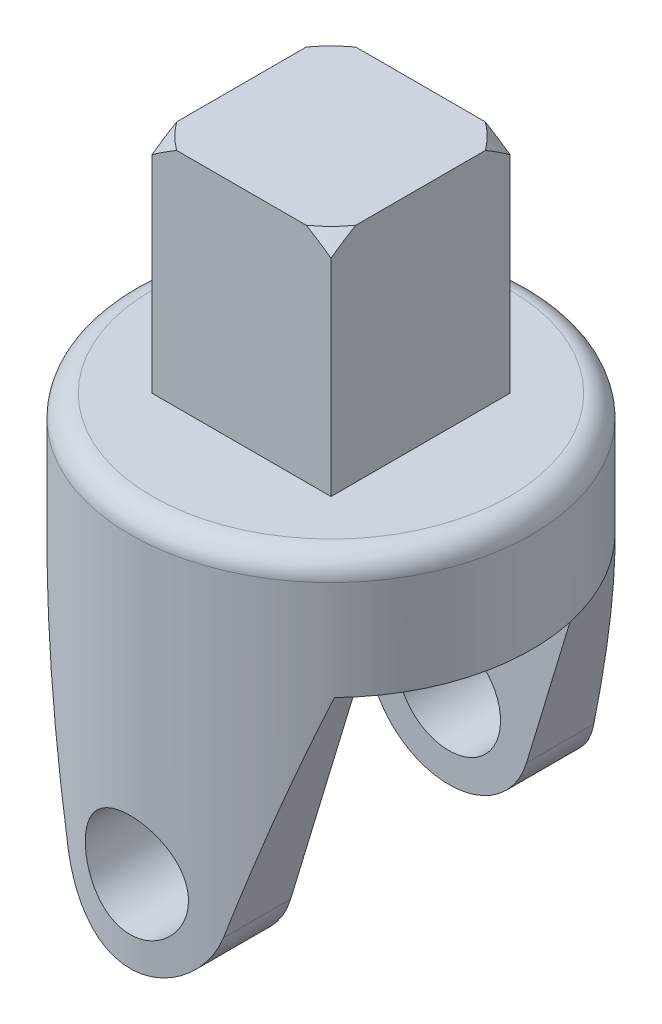
from build123d import *

# Parameters (mm, degrees)
BASE_R                  = 6.9215
BASE_EXTRUDE_DEPTH      = 13.716
MALEDRIVE_R             = 6.0579
DRIVE_EXTRUDE_DEPTH     = 7.6708
SQDRIVE_SK_OUTSIDE_W    = 21.642
SQDRIVE_SK_OUTSIDE_H    = 21.642
SQDRIVE_SK_OUTSIDE_W_2  = 6.1722
SQDRIVE_SK_OUTSIDE_H_2  = 6.1722
DRIVE_SQCUT_DEPTH       = 7.6708
BASE_FILLET_TOP_R       = 0.762
PROFILE1_CUT_DEPTH      = 24.520406857
PROFILE1_CUT_DEPTH_BACK = 24.520406857
PROFILE1_CUTSK_W        = 8.128
PROFILE1_CUTSK_H        = 9.525
PROFILE2_CUT_DEPTH      = 24.520406857
PROFILE2_CUT_DEPTH_BACK = 24.520406857
PIN_CUT_DEPTH           = 24.520406916
PIN_CUT_DEPTH_BACK      = 24.520406916
PIN_CUTSK_R             = 1.778


with BuildPart() as part:
    # Base → Base-Extrude (new body)
    with BuildSketch(Plane(origin=(0, 0, 0), x_dir=(1, 0, 0), z_dir=(0, 1, 0))):
        with Locations(Location((0, 0, 0), (0, 0, 270))):
            Circle(BASE_R)
    extrude(amount=BASE_EXTRUDE_DEPTH)

    # MaleDrive → Drive-Extrude (add)
    with BuildSketch(Plane(origin=(0, 13.716, 0), x_dir=(1, 0, 0), z_dir=(0, 1, 0))):
        with Locations(Location((0, 0, 0), (0, 0, 270))):
            Circle(MALEDRIVE_R)
    extrude(amount=DRIVE_EXTRUDE_DEPTH)

    # Drive-ChamCut → DriveEnd-Chamfer (revolve, cut)
    with BuildSketch(Plane.XY, mode=Mode.PRIVATE) as driveend_chamfer_sk:
        Polygon((-3.81, 21.3868), (-5.4229, 19.7739), (-5.4229, 21.3868), align=None)
    revolve(driveend_chamfer_sk.sketch.rotate(Axis((0, 0, 0), (0, 1, 0)), 270), axis=Axis((0, 0, 0), (0, 1, 0)), mode=Mode.SUBTRACT)

    # SQDrive-Sk outside → Drive-SQCut (cut)
    with BuildSketch(Plane(origin=(0, 21.3868, 0), x_dir=(-1, 0, 0), z_dir=(0, 1, 0))):
        Rectangle(SQDRIVE_SK_OUTSIDE_W, SQDRIVE_SK_OUTSIDE_H)
        Rectangle(SQDRIVE_SK_OUTSIDE_W_2, SQDRIVE_SK_OUTSIDE_H_2, mode=Mode.SUBTRACT)
    extrude(amount=-DRIVE_SQCUT_DEPTH, mode=Mode.SUBTRACT)

    # Base-Fillet_Top
    base_fillet_top_edges = [part.edges().sort_by_distance(p)[0] for p in [
        (0, 13.716, -6.9215),
    ]]
    fillet(base_fillet_top_edges, radius=BASE_FILLET_TOP_R)

    # Profile1-CutSk → Profile1-Cut (cut, two sides: drawn at the far end of the back side and taken through both)
    with BuildSketch(Plane(origin=(0, 0, 0), x_dir=(0, 0, -1), z_dir=(1, 0, 0)).offset(-PROFILE1_CUT_DEPTH_BACK)):
        with Locations((0, 4.7625)):
            Rectangle(PROFILE1_CUTSK_W, PROFILE1_CUTSK_H)
    extrude(amount=PROFILE1_CUT_DEPTH + PROFILE1_CUT_DEPTH_BACK, mode=Mode.SUBTRACT)

    # Profile2-CutSk → Profile2-Cut (cut, two sides: drawn at the far end of the back side and taken through both)
    with BuildSketch(Plane.XY.offset(-PROFILE2_CUT_DEPTH_BACK)):
        with BuildLine():
            Line((53.381392937, 9.525), (6.9215, 9.525))
            Line((6.9215, 9.525), (4.953, 9.525))
            Line((4.953, 9.525), (2.674532127, 1.985721643))
            ThreePointArc((2.674532127, 1.985721643), (0, 0), (-2.674532127, 1.985721643))
            Line((-2.674532127, 1.985721643), (-4.953, 9.525))
            Line((-4.953, 9.525), (-6.9215, 9.525))
            Line((-6.9215, 9.525), (-53.381392937, 9.525))
            Line((-53.381392937, 9.525), (-53.381392937, -83.394785874))
            Line((-53.381392937, -83.394785874), (53.381392937, -83.394785874))
            Line((53.381392937, -83.394785874), (53.381392937, 9.525))
        make_face()
    extrude(amount=PROFILE2_CUT_DEPTH + PROFILE2_CUT_DEPTH_BACK, mode=Mode.SUBTRACT)

    # Pin-CutSk → Pin-Cut (cut, two sides: drawn at the far end of the back side and taken through both)
    with BuildSketch(Plane.XY.offset(-PIN_CUT_DEPTH_BACK)):
        with Locations(Location((0, 2.794, 0), (0, 0, 90))):
            Circle(PIN_CUTSK_R)
    extrude(amount=PIN_CUT_DEPTH + PIN_CUT_DEPTH_BACK, mode=Mode.SUBTRACT)


solid = part.part
